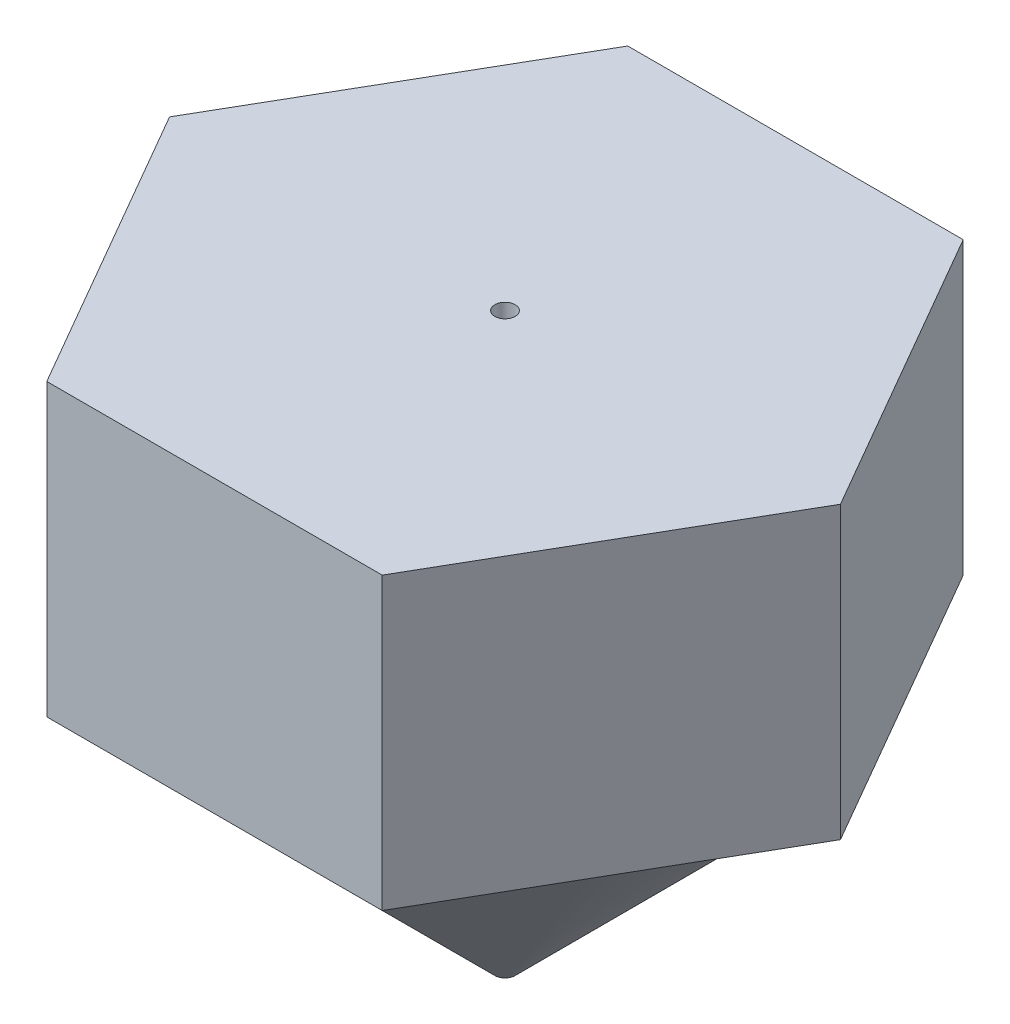
from build123d import *

# Parameters (mm, degrees)
BOSS_EXTRUDE1_DEPTH = 5
SKETCH4_R           = 0.175
CUT_EXTRUDE1_DEPTH  = 13.583057392


with BuildPart() as part:
    # Sketch1 → Boss-Extrude1 (new body)
    with BuildSketch(Plane(origin=(0, 0, 0), x_dir=(1, 0, 0), z_dir=(0, 1, 0))):
        Polygon((5.773502692, 0), (2.886751346, 5), (-2.886751346, 5), (-5.773502692, 0), (-2.886751346, -5), (2.886751346, -5), align=None)
    extrude(amount=-BOSS_EXTRUDE1_DEPTH)

    # Sketch3 → Revolve1 (revolve)
    with BuildSketch(Plane.XY):
        Polygon((0, -5), (0, -10), (-5, -5), align=None)
    revolve(axis=Axis((0, -5, 0), (0, -1, 0)))

    # Sketch4 → Cut-Extrude1 (cut, through all)
    with BuildSketch(Plane(origin=(0, 0, 0), x_dir=(1, 0, 0), z_dir=(0, 1, 0))):
        with Locations(Location((0, 0, 0), (0, 0, 270))):
            Circle(SKETCH4_R)
    extrude(amount=-CUT_EXTRUDE1_DEPTH, mode=Mode.SUBTRACT)


solid = part.part
